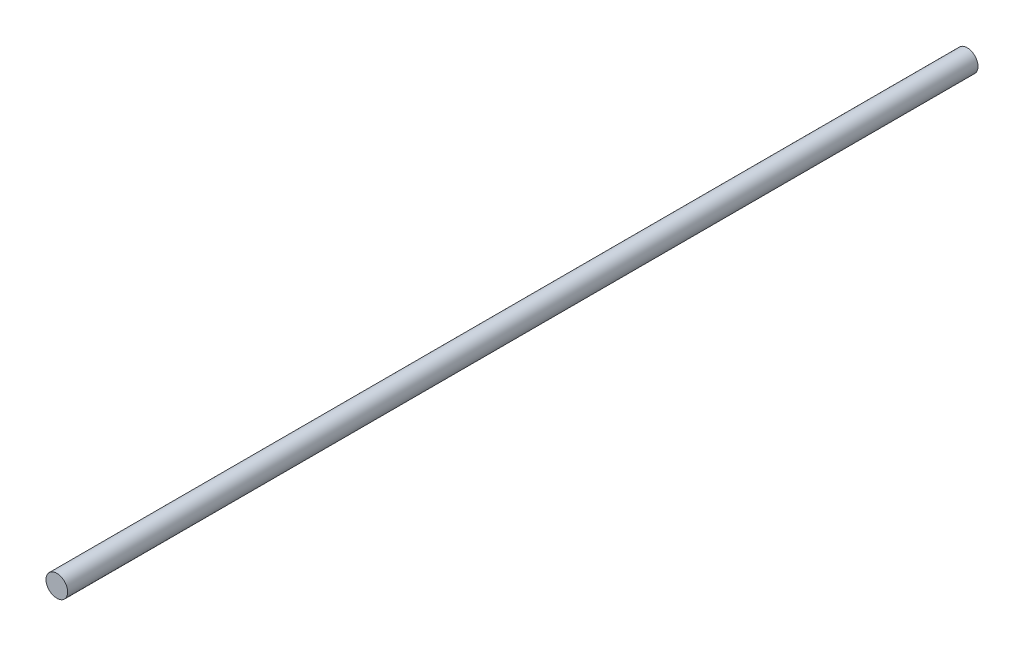
from build123d import *

# Parameters (mm, degrees)
ESQUISSE1_R        = 4
BOSS_EXTRU_1_DEPTH = 336


with BuildPart() as part:
    # Esquisse1 → Boss.-Extru.1 (new body)
    with BuildSketch(Plane.XY):
        with Locations(Location((0, 0, 0), (0, 0, 180))):
            Circle(ESQUISSE1_R)
    extrude(amount=BOSS_EXTRU_1_DEPTH)


solid = part.part
